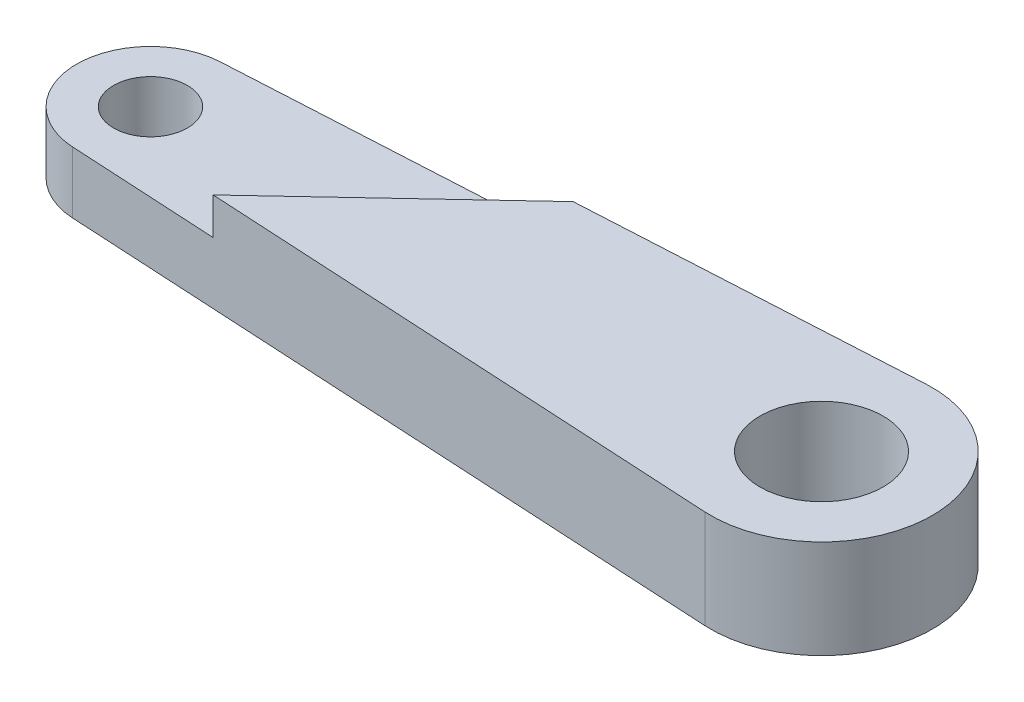
from build123d import *

# Parameters (mm, degrees)
SKETCH_1_R          = 3
SKETCH_1_R_2        = 5
EXTRUDE_1_DEPTH     = 4
CUT_EXTRUDE_1_DEPTH = 3


with BuildPart() as part:
    # 草图1 → 凸台-拉伸1 (new, symmetric)
    with BuildSketch(Plane(origin=(0, 0, 0), x_dir=(1, 0, 0), z_dir=(0, 1, 0))):
        with BuildLine():
            ThreePointArc((-0.330275229, 5.99090296), (-6, 0), (-0.330275229, -5.99090296))
            Line((-0.330275229, -5.99090296), (54.004587156, -8.98635444))
            ThreePointArc((54.004587156, -8.98635444), (63.5, 0), (54.004587156, 8.98635444))
            Line((54.004587156, 8.98635444), (-0.330275229, 5.99090296))
        make_face()
        with Locations(Location((0, 0, 0), (0, 0, 270))):
            Circle(SKETCH_1_R, mode=Mode.SUBTRACT)
        with Locations(Location((54.5, 0, 0), (0, 0, 270))):
            Circle(SKETCH_1_R_2, mode=Mode.SUBTRACT)
    extrude(amount=EXTRUDE_1_DEPTH, both=True)

    # 草图2 → 切除-拉伸1 (cut)
    with BuildSketch(Plane(origin=(0, 4, 0), x_dir=(1, 0, 0), z_dir=(0, 1, 0))):
        Polygon((26.837155963, 7.4886287), (11.750234203, -6.65689489), (-12.859516692, -6.65689489), (-12.859516692, 10.73344258), align=None)
    extrude(amount=-CUT_EXTRUDE_1_DEPTH, mode=Mode.SUBTRACT)


solid = part.part
